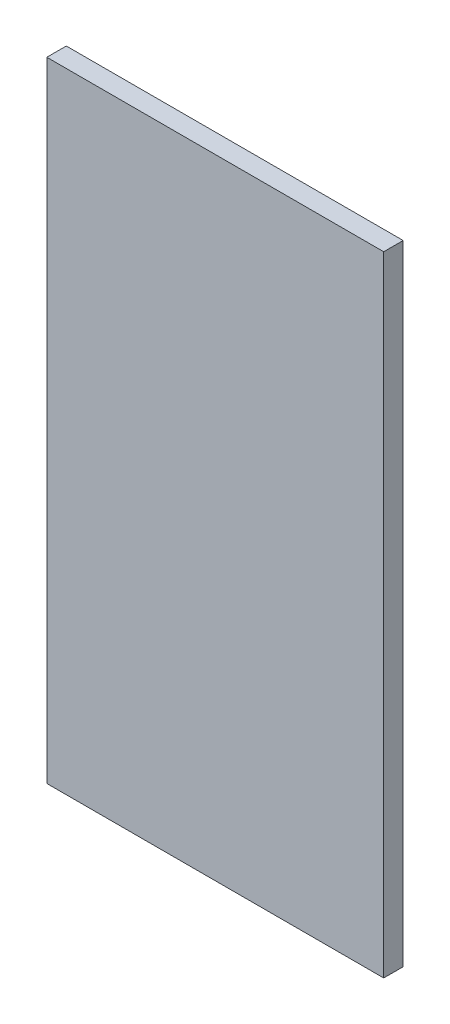
from build123d import *

# Parameters (mm, degrees)
SKETCH_1_W      = 346
SKETCH_1_H      = 646
EXTRUDE_1_DEPTH = 20


with BuildPart() as part:
    # 草圖1 → 填料-伸長1 (new body)
    with BuildSketch(Plane.XY):
        Rectangle(SKETCH_1_W, SKETCH_1_H)
    extrude(amount=EXTRUDE_1_DEPTH)


solid = part.part
